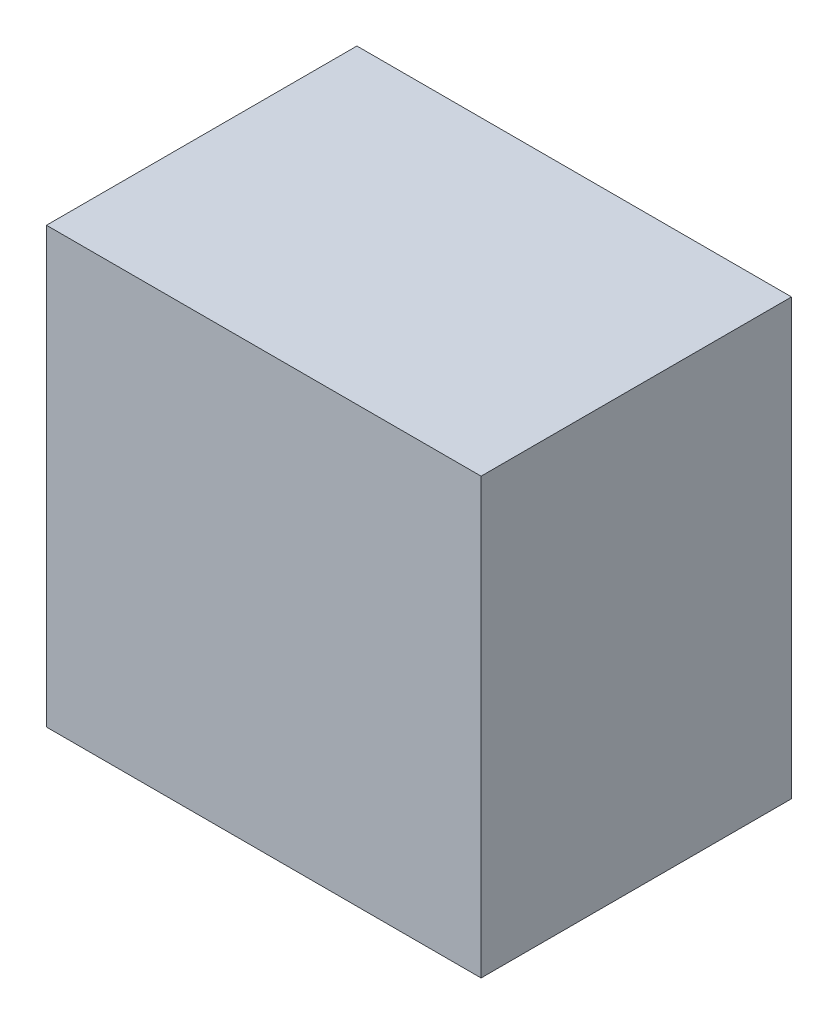
from build123d import *

# Parameters (mm, degrees)
SM_MOTOR_TARAK_57X57X40_1_START = -740
SKETCH1_W                       = 56
SKETCH1_H                       = 56
SM_MOTOR_TARAK_57X57X40_1_DEPTH = 40


with BuildPart() as part:
    # Sketch1 → SM_motor_tarak_57x57x40_1 (new body)
    with BuildSketch(Plane.XY.offset(SM_MOTOR_TARAK_57X57X40_1_START)):
        with Locations((0, 170)):
            Rectangle(SKETCH1_W, SKETCH1_H)
    extrude(amount=-SM_MOTOR_TARAK_57X57X40_1_DEPTH)


solid = part.part
